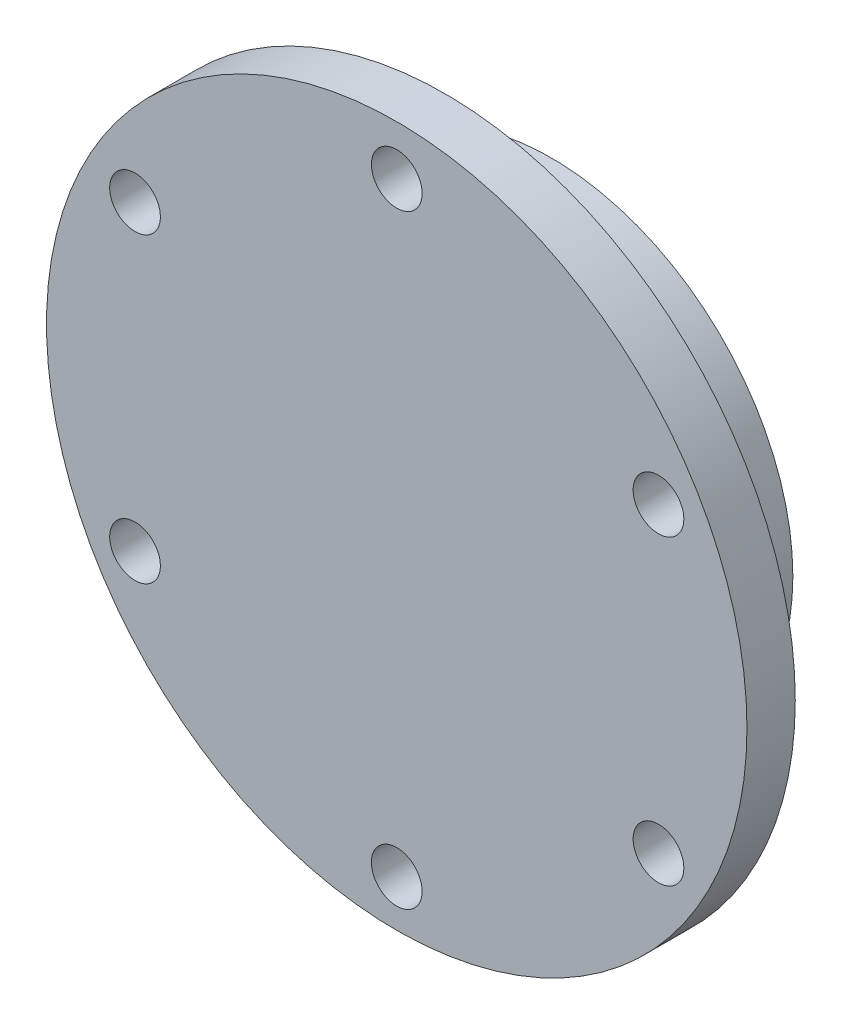
from build123d import *

# Parameters (mm, degrees)
CROQUIS1_R              = 72.5
SALIENTE_EXTRUIR1_DEPTH = 10
MATRIZC3_COUNT          = 6
CROQUIS13_R             = 50
SALIENTE_EXTRUIR2_DEPTH = 22


with BuildPart() as part:
    # Croquis1 → Saliente-Extruir1 (new body)
    with BuildSketch(Plane.XY):
        Circle(CROQUIS1_R)
    extrude(amount=SALIENTE_EXTRUIR1_DEPTH)

    # Croquis12 → Perforador para roscar para macho de roscar para M12x1.51 (revolve, cut)
    with BuildSketch(Plane(origin=(0, 62.233623097, 0), x_dir=(0, 1, 0), z_dir=(1, 0, 0))):
        Polygon((0, 0), (0, 46.65451825), (5.25, 43.5), (5.25, 0), align=None)
    perforador_para_roscar_para_macho_de_ros = revolve(axis=Axis((0, 62.233623097, -6.35), (0, 0, 1)), mode=Mode.SUBTRACT)

    # MatrizC3: Perforador para roscar para macho de roscar para M12x1.51 ×6 about axis
    matrizc3_axis = Axis((0, -0.328058282, 0), (0, 0, 1))
    for i in range(1, MATRIZC3_COUNT):
        add(perforador_para_roscar_para_macho_de_ros.rotate(matrizc3_axis, i * 360 / MATRIZC3_COUNT), mode=Mode.SUBTRACT)

    # Croquis13 → Saliente-Extruir2 (add)
    with BuildSketch(Plane(origin=(0, 0, 0), x_dir=(-1, 0, 0), z_dir=(0, 0, -1))):
        Circle(CROQUIS13_R)
    extrude(amount=SALIENTE_EXTRUIR2_DEPTH)


solid = part.part
